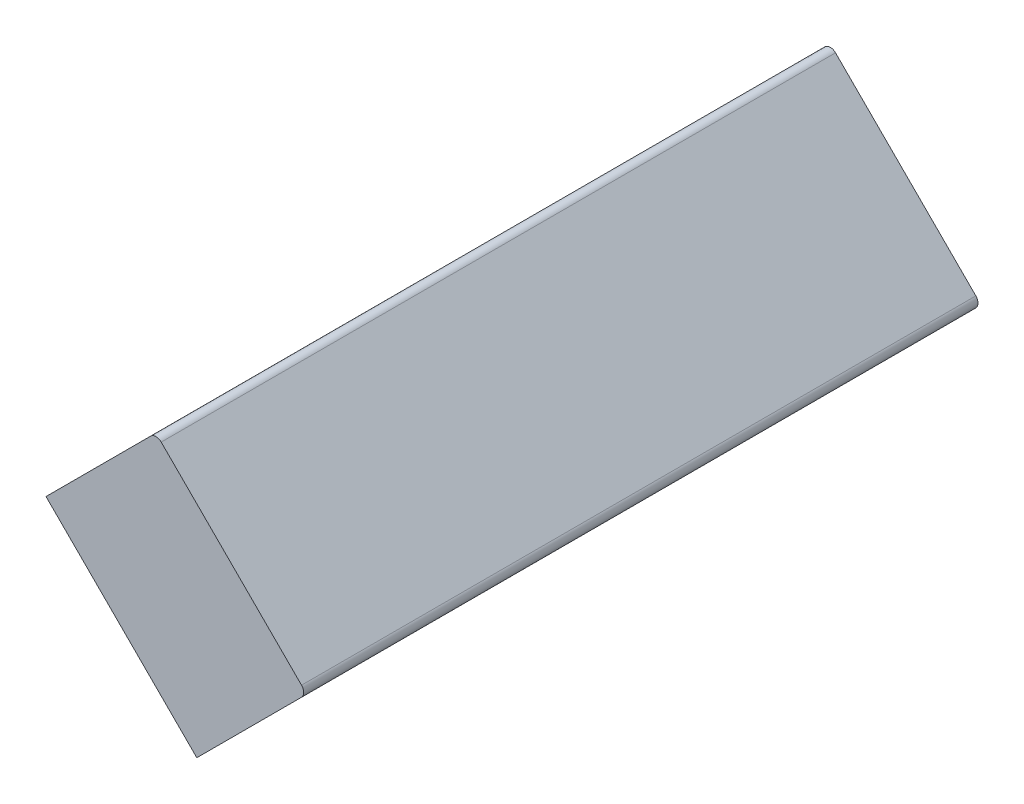
from build123d import *

# Parameters (mm, degrees)
HEAD_START           = -383.38
HEAD_CASTING_DEPTH   = 455.28
INTAKE_START         = -2.1
INTAKE_PORT_1_DEPTH  = 28
EXHAUST_START        = -4.1
EXHAUST_PORT_1_DEPTH = 32
INTAKE_START_2       = -113.86
INTAKE_PORT_3_DEPTH  = 28
EXHAUST_START_2      = -115.86
EXHAUST_PORT_3_DEPTH = 32
INTAKE_START_3       = -225.62
INTAKE_PORT_5_DEPTH  = 28
EXHAUST_START_3      = -227.62
EXHAUST_PORT_5_DEPTH = 32
INTAKE_START_4       = -337.38
INTAKE_PORT_7_DEPTH  = 28
EXHAUST_START_4      = -339.38
EXHAUST_PORT_7_DEPTH = 32


with BuildPart() as part:
    # Sketch1 → Head Casting (new body)
    with BuildSketch(Plane.XY.offset(HEAD_START)):
        with BuildLine():
            Line((115.223049994, 217.046426485), (217.046426485, 115.223049994))
            Line((217.046426485, 115.223049994), (287.757104604, 185.933728113))
            ThreePointArc((287.757104604, 185.933728113), (289.221570698, 189.469262019), (287.757104604, 193.004795925))
            Line((287.757104604, 193.004795925), (193.004795925, 287.757104604))
            ThreePointArc((193.004795925, 287.757104604), (189.469262019, 289.221570698), (185.933728113, 287.757104604))
            Line((185.933728113, 287.757104604), (115.223049994, 217.046426485))
        make_face()
    extrude(amount=HEAD_CASTING_DEPTH)

    # Sketch2 → Intake Port 1 (cut)
    with BuildSketch(Plane.XY.offset(INTAKE_START)):
        with BuildLine():
            Line((135.729146649, 238.966736702), (153.406816178, 221.289067172))
            ThreePointArc((153.406816178, 221.289067172), (157.649456866, 219.531707859), (161.892097553, 221.289067172))
            Line((161.892097553, 221.289067172), (181.691087426, 241.088057046))
            ThreePointArc((181.691087426, 241.088057046), (183.448446739, 245.330697733), (181.691087426, 249.57333842))
            Line((181.691087426, 249.57333842), (164.013417896, 267.251007949))
            Line((164.013417896, 267.251007949), (135.729146649, 238.966736702))
        make_face()
    extrude(amount=INTAKE_PORT_1_DEPTH, mode=Mode.SUBTRACT)

    # Sketch3 → Exhaust Port 1 (cut)
    with BuildSketch(Plane.XY.offset(EXHAUST_START)):
        with BuildLine():
            Line((240.380950264, 137.143360211), (224.117494297, 153.406816178))
            ThreePointArc((224.117494297, 153.406816178), (221.774348547, 159.063670428), (224.117494297, 164.720524677))
            Line((224.117494297, 164.720524677), (238.259629921, 178.862660301))
            ThreePointArc((238.259629921, 178.862660301), (243.91648417, 181.205806052), (249.57333842, 178.862660301))
            Line((249.57333842, 178.862660301), (265.836794387, 162.599204334))
            Line((265.836794387, 162.599204334), (240.380950264, 137.143360211))
        make_face()
    extrude(amount=EXHAUST_PORT_1_DEPTH, mode=Mode.SUBTRACT)

    # Sketch4 → Intake Port 3 (cut)
    with BuildSketch(Plane.XY.offset(INTAKE_START_2)):
        with BuildLine():
            Line((135.729146649, 238.966736702), (153.406816178, 221.289067172))
            ThreePointArc((153.406816178, 221.289067172), (157.649456866, 219.531707859), (161.892097553, 221.289067172))
            Line((161.892097553, 221.289067172), (181.691087426, 241.088057046))
            ThreePointArc((181.691087426, 241.088057046), (183.448446739, 245.330697733), (181.691087426, 249.57333842))
            Line((181.691087426, 249.57333842), (164.013417896, 267.251007949))
            Line((164.013417896, 267.251007949), (135.729146649, 238.966736702))
        make_face()
    extrude(amount=INTAKE_PORT_3_DEPTH, mode=Mode.SUBTRACT)

    # Sketch5 → Exhaust Port 3 (cut)
    with BuildSketch(Plane.XY.offset(EXHAUST_START_2)):
        with BuildLine():
            Line((240.380950264, 137.143360211), (224.117494297, 153.406816178))
            ThreePointArc((224.117494297, 153.406816178), (221.774348547, 159.063670428), (224.117494297, 164.720524677))
            Line((224.117494297, 164.720524677), (238.259629921, 178.862660301))
            ThreePointArc((238.259629921, 178.862660301), (243.91648417, 181.205806052), (249.57333842, 178.862660301))
            Line((249.57333842, 178.862660301), (265.836794387, 162.599204334))
            Line((265.836794387, 162.599204334), (240.380950264, 137.143360211))
        make_face()
    extrude(amount=EXHAUST_PORT_3_DEPTH, mode=Mode.SUBTRACT)

    # Sketch6 → Intake Port 5 (cut)
    with BuildSketch(Plane.XY.offset(INTAKE_START_3)):
        with BuildLine():
            Line((135.729146649, 238.966736702), (153.406816178, 221.289067172))
            ThreePointArc((153.406816178, 221.289067172), (157.649456866, 219.531707859), (161.892097553, 221.289067172))
            Line((161.892097553, 221.289067172), (181.691087426, 241.088057046))
            ThreePointArc((181.691087426, 241.088057046), (183.448446739, 245.330697733), (181.691087426, 249.57333842))
            Line((181.691087426, 249.57333842), (164.013417896, 267.251007949))
            Line((164.013417896, 267.251007949), (135.729146649, 238.966736702))
        make_face()
    extrude(amount=INTAKE_PORT_5_DEPTH, mode=Mode.SUBTRACT)

    # Sketch7 → Exhaust Port 5 (cut)
    with BuildSketch(Plane.XY.offset(EXHAUST_START_3)):
        with BuildLine():
            Line((240.380950264, 137.143360211), (224.117494297, 153.406816178))
            ThreePointArc((224.117494297, 153.406816178), (221.774348547, 159.063670428), (224.117494297, 164.720524677))
            Line((224.117494297, 164.720524677), (238.259629921, 178.862660301))
            ThreePointArc((238.259629921, 178.862660301), (243.91648417, 181.205806052), (249.57333842, 178.862660301))
            Line((249.57333842, 178.862660301), (265.836794387, 162.599204334))
            Line((265.836794387, 162.599204334), (240.380950264, 137.143360211))
        make_face()
    extrude(amount=EXHAUST_PORT_5_DEPTH, mode=Mode.SUBTRACT)

    # Sketch8 → Intake Port 7 (cut)
    with BuildSketch(Plane.XY.offset(INTAKE_START_4)):
        with BuildLine():
            Line((135.729146649, 238.966736702), (153.406816178, 221.289067172))
            ThreePointArc((153.406816178, 221.289067172), (157.649456866, 219.531707859), (161.892097553, 221.289067172))
            Line((161.892097553, 221.289067172), (181.691087426, 241.088057046))
            ThreePointArc((181.691087426, 241.088057046), (183.448446739, 245.330697733), (181.691087426, 249.57333842))
            Line((181.691087426, 249.57333842), (164.013417896, 267.251007949))
            Line((164.013417896, 267.251007949), (135.729146649, 238.966736702))
        make_face()
    extrude(amount=INTAKE_PORT_7_DEPTH, mode=Mode.SUBTRACT)

    # Sketch9 → Exhaust Port 7 (cut)
    with BuildSketch(Plane.XY.offset(EXHAUST_START_4)):
        with BuildLine():
            Line((240.380950264, 137.143360211), (224.117494297, 153.406816178))
            ThreePointArc((224.117494297, 153.406816178), (221.774348547, 159.063670428), (224.117494297, 164.720524677))
            Line((224.117494297, 164.720524677), (238.259629921, 178.862660301))
            ThreePointArc((238.259629921, 178.862660301), (243.91648417, 181.205806052), (249.57333842, 178.862660301))
            Line((249.57333842, 178.862660301), (265.836794387, 162.599204334))
            Line((265.836794387, 162.599204334), (240.380950264, 137.143360211))
        make_face()
    extrude(amount=EXHAUST_PORT_7_DEPTH, mode=Mode.SUBTRACT)


solid = part.part
